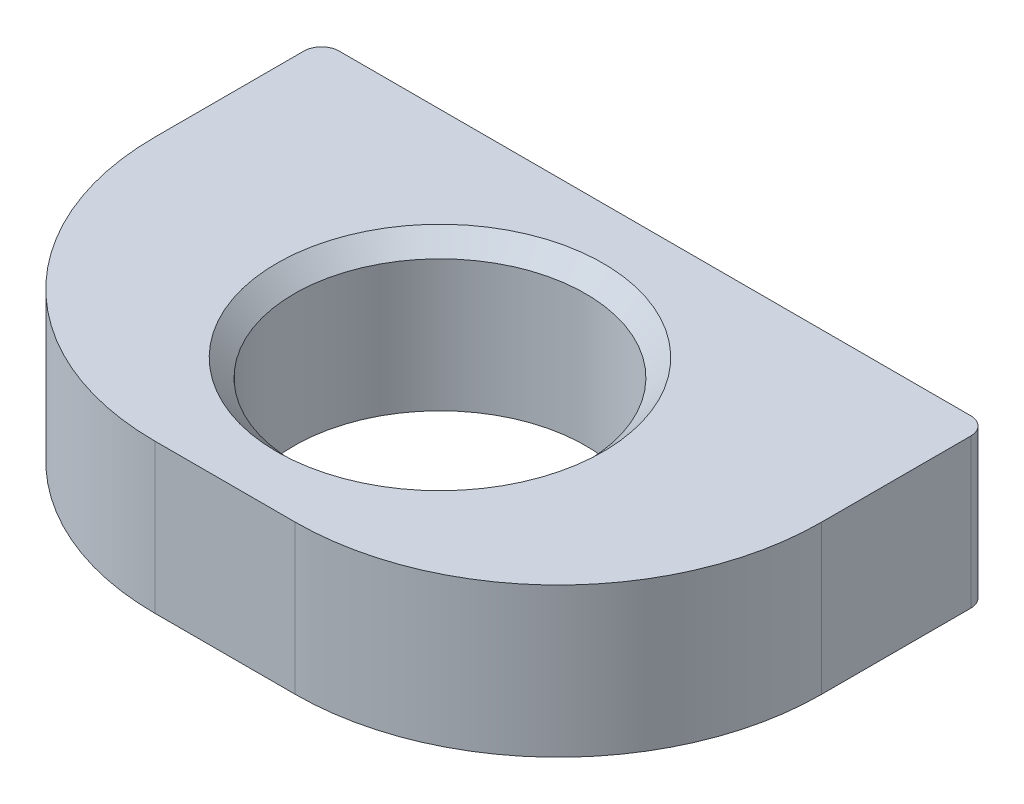
from build123d import *

# Parameters (mm, degrees)
SKETCH1_W           = 38
SKETCH1_H           = 24.5
SKETCH1_R           = 8.3
BOSS_EXTRUDE1_DEPTH = 8.5
FILLET1_R           = 15
FILLET2_R           = 1
CHAMFER1_SIZE       = 1


with BuildPart() as part:
    # Sketch1 → Boss-Extrude1 (new body)
    with BuildSketch(Plane(origin=(0, 0, 0), x_dir=(1, 0, 0), z_dir=(0, 1, 0))):
        Rectangle(SKETCH1_W, SKETCH1_H)
        with Locations(Location((0, 0, 0), (0, 0, 270))):
            Circle(SKETCH1_R, mode=Mode.SUBTRACT)
    extrude(amount=BOSS_EXTRUDE1_DEPTH)

    # Fillet1
    fillet1_edges = [part.edges().sort_by_distance(p)[0] for p in [
        (19, 4.25, 12.25),
        (-19, 4.25, 12.25),
    ]]
    fillet(fillet1_edges, radius=FILLET1_R)

    # Fillet2
    fillet2_edges = [part.edges().sort_by_distance(p)[0] for p in [
        (-19, 4.25, -12.25),
        (19, 4.25, -12.25),
    ]]
    fillet(fillet2_edges, radius=FILLET2_R)

    # Chamfer1
    chamfer1_edges = [part.edges().sort_by_distance(p)[0] for p in [
        (0, 8.5, -8.3),
    ]]
    chamfer(chamfer1_edges, length=CHAMFER1_SIZE)


solid = part.part
